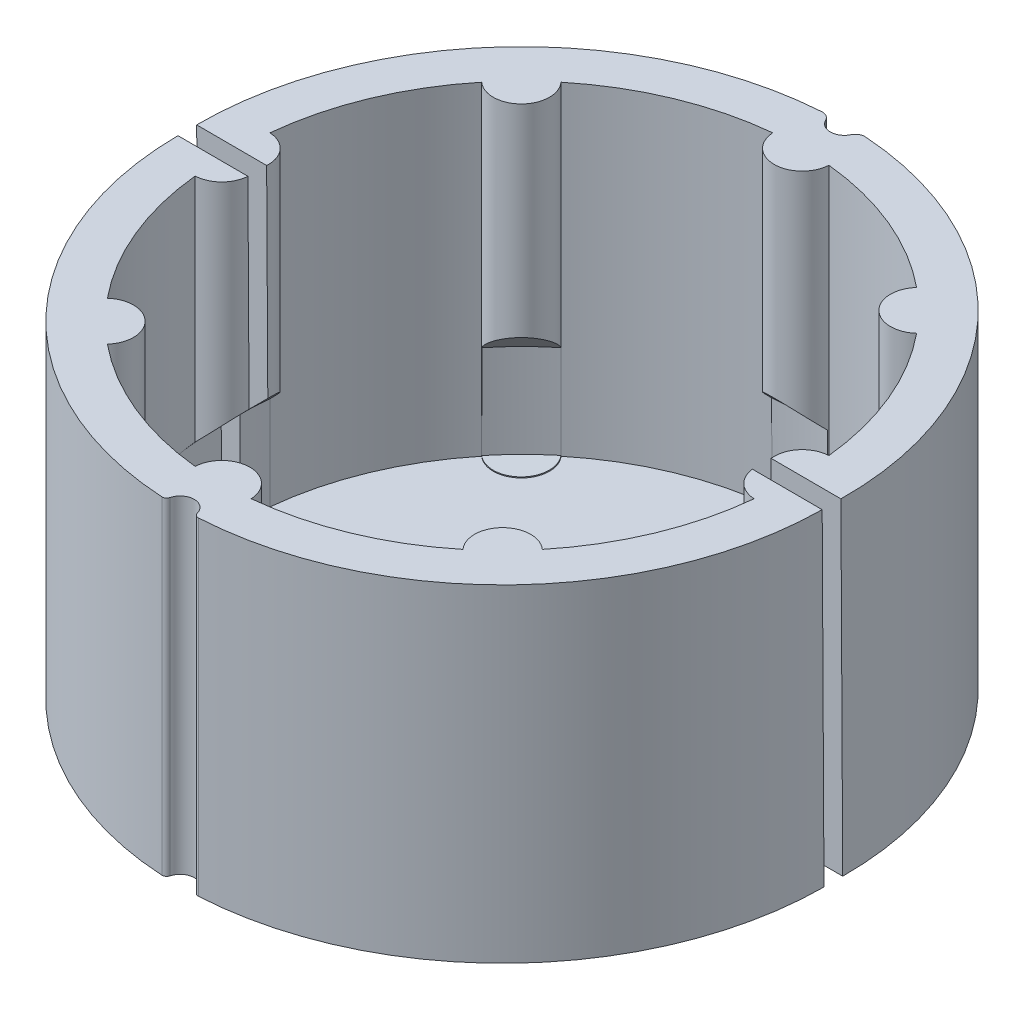
from build123d import *

# Parameters (mm, degrees)
BOSS_EXTRUDE1_DEPTH = 35
CUT_EXTRUDE2_DEPTH  = 61.012997416
BOSS_EXTRUDE2_DEPTH = 0.4


with BuildPart() as part:
    # Sketch1 → Boss-Extrude1 (new body)
    with BuildSketch(Plane(origin=(0, 0, 0), x_dir=(1, 0, 0), z_dir=(0, 1, 0))):
        with BuildLine():
            ThreePointArc((1.451818925, -34.068556857), (1.641248992, -34.346908706), (1.964225605, -34.442038138))
            ThreePointArc((1.964225605, -34.442038138), (26.591847487, -21.978073076), (34.198225299, 4.555174015))
            ThreePointArc((34.198225299, 4.555174015), (23.590291339, 25.176355888), (2.324135821, 34.423627607))
            ThreePointArc((2.324135821, 34.423627607), (1.751838249, 34.289058819), (1.354061739, 33.856153382))
            ThreePointArc((1.354061739, 33.856153382), (0, 33.001534515), (-1.354061739, 33.856153382))
            ThreePointArc((-1.354061739, 33.856153382), (-1.751838249, 34.289058819), (-2.324135821, 34.423627607))
            ThreePointArc((-2.324135821, 34.423627607), (-23.590291339, 25.176355888), (-34.198225299, 4.555174015))
            ThreePointArc((-34.198225299, 4.555174015), (-26.591847487, -21.978073076), (-1.964225605, -34.442038138))
            ThreePointArc((-1.964225605, -34.442038138), (-1.641248992, -34.346908706), (-1.451818925, -34.068556857))
            ThreePointArc((-1.451818925, -34.068556857), (0, -32.945679925), (1.451818925, -34.068556857))
        make_face()
        with BuildLine():
            Line((-2.417, 3.787737139), (0, 3.787737139))
            Line((0, 3.787737139), (2.417, 3.787737139))
            ThreePointArc((2.417, 3.787737139), (0, -4.489512172), (-2.417, 3.787737139))
        make_face(mode=Mode.SUBTRACT)
    extrude(amount=BOSS_EXTRUDE1_DEPTH)

    # Sketch2 → Cut-Extrude2 (cut, through all)
    with BuildSketch(Plane(origin=(0, 0, 0), x_dir=(1, 0, 0), z_dir=(0, 1, 0))):
        with BuildLine():
            ThreePointArc((-23.225804452, 18.988470385), (-27.716385975, 11.480502971), (-29.85, 2.996247653))
            ThreePointArc((-29.85, 2.996247653), (-27, 0), (-29.85, -2.996247653))
            ThreePointArc((-29.85, -2.996247653), (-27.716385975, -11.480502971), (-23.225804452, -18.988470385))
            ThreePointArc((-23.225804452, -18.988470385), (-19.091883092, -19.091883092), (-18.988470385, -23.225804452))
            ThreePointArc((-18.988470385, -23.225804452), (-11.480502971, -27.716385975), (-2.996247653, -29.85))
            ThreePointArc((-2.996247653, -29.85), (0, -27), (2.996247653, -29.85))
            ThreePointArc((2.996247653, -29.85), (11.480502971, -27.716385975), (18.988470385, -23.225804452))
            ThreePointArc((18.988470385, -23.225804452), (19.091883092, -19.091883092), (23.225804452, -18.988470385))
            ThreePointArc((23.225804452, -18.988470385), (27.716385975, -11.480502971), (29.85, -2.996247653))
            ThreePointArc((29.85, -2.996247653), (27, 0), (29.85, 2.996247653))
            ThreePointArc((29.85, 2.996247653), (27.716385975, 11.480502971), (23.225804452, 18.988470385))
            ThreePointArc((23.225804452, 18.988470385), (19.091883092, 19.091883092), (18.988470385, 23.225804452))
            ThreePointArc((18.988470385, 23.225804452), (11.480502971, 27.716385975), (2.996247653, 29.85))
            ThreePointArc((2.996247653, 29.85), (0, 27), (-2.996247653, 29.85))
            ThreePointArc((-2.996247653, 29.85), (-11.480502971, 27.716385975), (-18.988470385, 23.225804452))
            ThreePointArc((-18.988470385, 23.225804452), (-19.091883092, 19.091883092), (-23.225804452, 18.988470385))
        make_face()
    extrude(amount=CUT_EXTRUDE2_DEPTH, mode=Mode.SUBTRACT)

    # Sketch2<2> → Boss-Extrude2 (add)
    with BuildSketch(Plane(origin=(0, 0, 0), x_dir=(1, 0, 0), z_dir=(0, 1, 0))):
        with BuildLine():
            ThreePointArc((-23.225804452, 18.988470385), (-27.716385975, 11.480502971), (-29.85, 2.996247653))
            ThreePointArc((-29.85, 2.996247653), (-27, 0), (-29.85, -2.996247653))
            ThreePointArc((-29.85, -2.996247653), (-27.716385975, -11.480502971), (-23.225804452, -18.988470385))
            ThreePointArc((-23.225804452, -18.988470385), (-19.091883092, -19.091883092), (-18.988470385, -23.225804452))
            ThreePointArc((-18.988470385, -23.225804452), (-11.480502971, -27.716385975), (-2.996247653, -29.85))
            ThreePointArc((-2.996247653, -29.85), (0, -27), (2.996247653, -29.85))
            ThreePointArc((2.996247653, -29.85), (11.480502971, -27.716385975), (18.988470385, -23.225804452))
            ThreePointArc((18.988470385, -23.225804452), (19.091883092, -19.091883092), (23.225804452, -18.988470385))
            ThreePointArc((23.225804452, -18.988470385), (27.716385975, -11.480502971), (29.85, -2.996247653))
            ThreePointArc((29.85, -2.996247653), (27, 0), (29.85, 2.996247653))
            ThreePointArc((29.85, 2.996247653), (27.716385975, 11.480502971), (23.225804452, 18.988470385))
            ThreePointArc((23.225804452, 18.988470385), (19.091883092, 19.091883092), (18.988470385, 23.225804452))
            ThreePointArc((18.988470385, 23.225804452), (11.480502971, 27.716385975), (2.996247653, 29.85))
            ThreePointArc((2.996247653, 29.85), (0, 27), (-2.996247653, 29.85))
            ThreePointArc((-2.996247653, 29.85), (-11.480502971, 27.716385975), (-18.988470385, 23.225804452))
            ThreePointArc((-18.988470385, 23.225804452), (-19.091883092, 19.091883092), (-23.225804452, 18.988470385))
        make_face()
    extrude(amount=BOSS_EXTRUDE2_DEPTH)

    # Sketch3 → Cut-Revolve6 (revolve, cut)
    with BuildSketch(Plane(origin=(-0.00022925, -0.000451943, 0.082929085), x_dir=(0.9999961791641001, -1.638393917709602e-05, 0.002764306200087237), z_dir=(-0.002764354438420585, -0.005449652896477143, 0.9999813296396323))):
        Polygon((0, 0.4), (30, 0.4), (30, 10.4), (20.928551174, 19.471448826), (0, 5.4), align=None)
    revolve(axis=Axis((-0.000228722, 0.399542117, 0.085108956), (1.3191239929922023e-06, 0.9999851503971819, 0.005449677365262697)), mode=Mode.SUBTRACT)


with BuildPart() as body_2:
    # Split1: the piece on the far side of the plane
    add(part.part)
    split(bisect_by=Plane(origin=(-0.00022925, -0.000451943, 0.082929085), x_dir=(0, 0.9999851504179245, 0.005449673718781389), z_dir=(-0.002764354438420585, -0.005449652896477143, 0.9999813296396323)), keep=Keep.BOTTOM)


with BuildPart() as part_1:
    add(part.part)

    # Split1
    split(bisect_by=Plane(origin=(-0.00022925, -0.000451943, 0.082929085), x_dir=(0, 0.9999851504179245, 0.005449673718781389), z_dir=(-0.002764354438420585, -0.005449652896477143, 0.9999813296396323)), keep=Keep.TOP)


with BuildPart() as body_2_1:
    # Body-Move/Copy1: moved
    add(body_2.part.moved(Location((0, 0, -2))))


solid = Compound([part_1.part, body_2_1.part])
